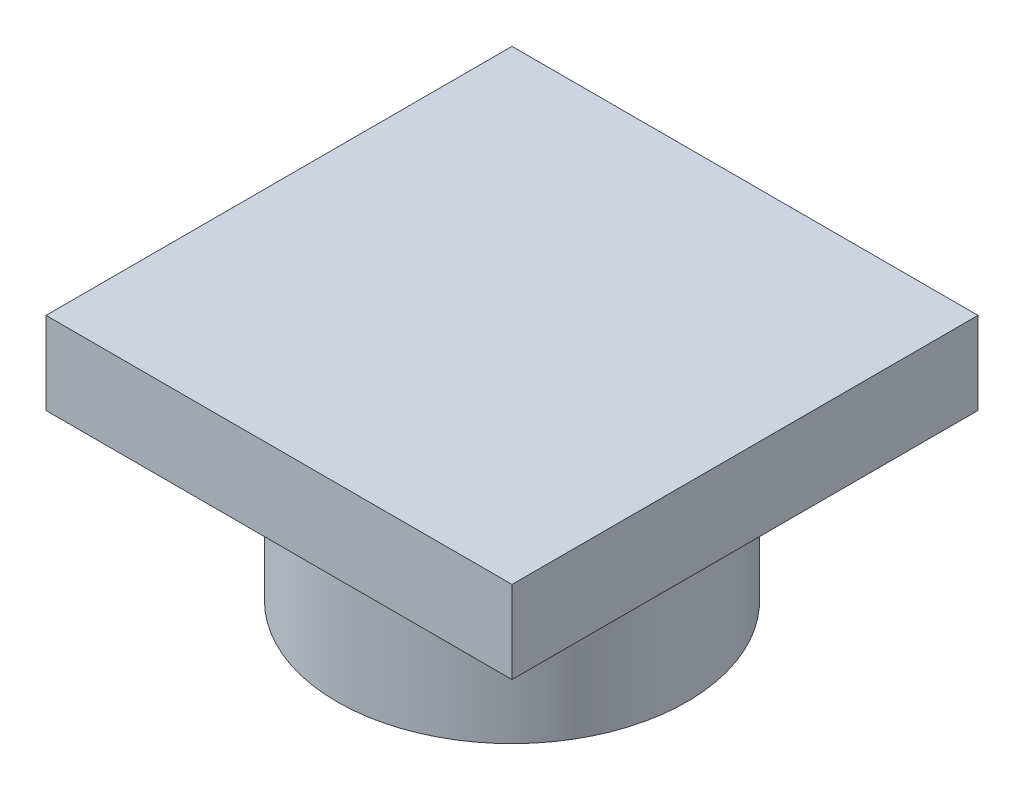
from build123d import *

# Parameters (mm, degrees)
SKETCH1_R           = 4.25
BOSS_EXTRUDE1_DEPTH = 4
SKETCH2_W           = 11.313708498
SKETCH2_H           = 11.313708498
BOSS_EXTRUDE2_DEPTH = 2


with BuildPart() as part:
    # Sketch1 → Boss-Extrude1 (new body)
    with BuildSketch(Plane(origin=(0, 0, 0), x_dir=(1, 0, 0), z_dir=(0, 1, 0))):
        with Locations(Location((0, 0, 0), (0, 0, 270))):
            Circle(SKETCH1_R)
    extrude(amount=BOSS_EXTRUDE1_DEPTH)

    # Sketch2 → Boss-Extrude2 (add)
    with BuildSketch(Plane(origin=(0, 4, 0), x_dir=(1, 0, 0), z_dir=(0, 1, 0))):
        Rectangle(SKETCH2_W, SKETCH2_H)
    extrude(amount=BOSS_EXTRUDE2_DEPTH)


solid = part.part
